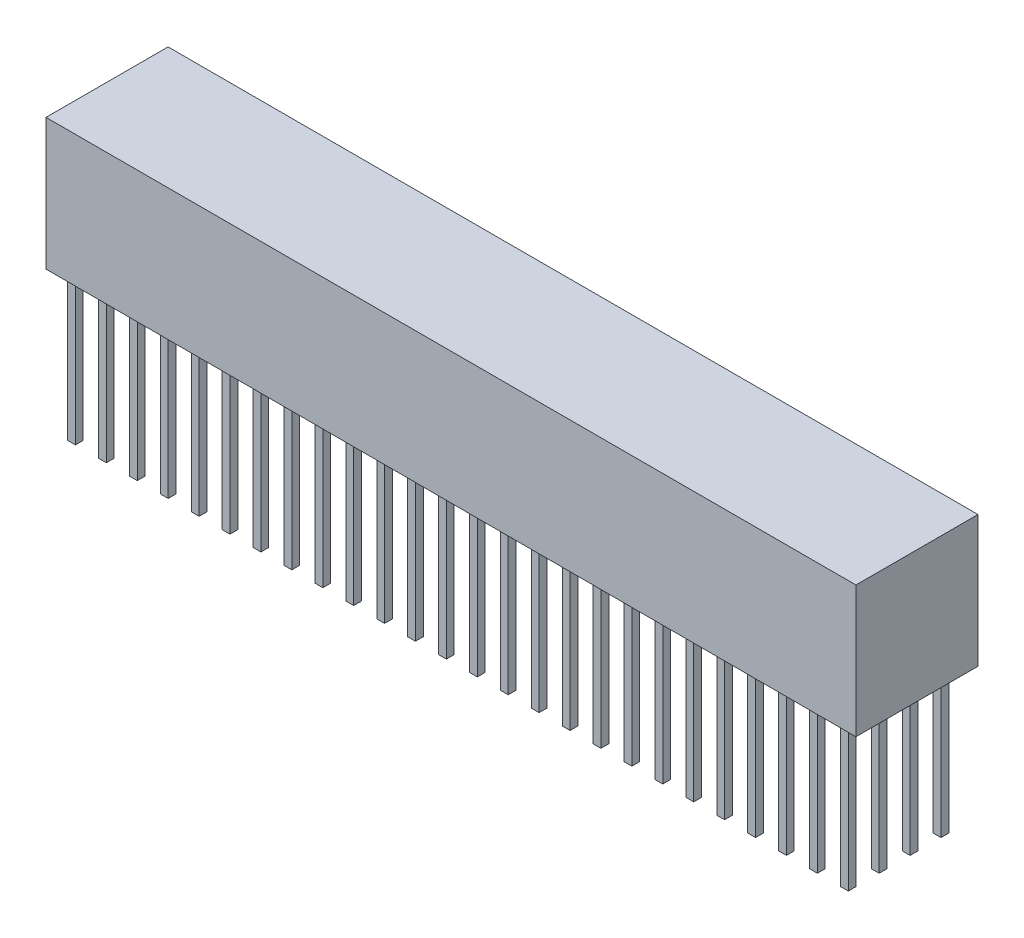
from build123d import *

# Parameters (mm, degrees)
SKETCH1_W           = 66.55
SKETCH1_H           = 10.03
BOSS_EXTRUDE1_DEPTH = 10.8
SKETCH2_W           = 0.64
SKETCH2_H           = 0.64
BOSS_EXTRUDE2_DEPTH = 12.19


with BuildPart() as part:
    # Sketch1 → Boss-Extrude1 (new body)
    with BuildSketch(Plane(origin=(0, 0, 0), x_dir=(1, 0, 0), z_dir=(0, 1, 0))):
        with Locations((33.275, 5.015)):
            Rectangle(SKETCH1_W, SKETCH1_H)
    extrude(amount=BOSS_EXTRUDE1_DEPTH)

    # Sketch2 → Boss-Extrude2 (add)
    with BuildSketch(Plane.XZ):
        with Locations((1.21, -1.21)):
            Rectangle(SKETCH2_W, SKETCH2_H)
        with Locations((3.75, -1.21)):
            Rectangle(SKETCH2_W, SKETCH2_H)
        with Locations((6.29, -1.21)):
            Rectangle(SKETCH2_W, SKETCH2_H)
        with Locations((8.83, -1.21)):
            Rectangle(SKETCH2_W, SKETCH2_H)
        with Locations((11.37, -1.21)):
            Rectangle(SKETCH2_W, SKETCH2_H)
        with Locations((13.91, -1.21)):
            Rectangle(SKETCH2_W, SKETCH2_H)
        with Locations((16.45, -1.21)):
            Rectangle(SKETCH2_W, SKETCH2_H)
        with Locations((18.99, -1.21)):
            Rectangle(SKETCH2_W, SKETCH2_H)
        with Locations((21.53, -1.21)):
            Rectangle(SKETCH2_W, SKETCH2_H)
        with Locations((24.07, -1.21)):
            Rectangle(SKETCH2_W, SKETCH2_H)
        with Locations((26.61, -1.21)):
            Rectangle(SKETCH2_W, SKETCH2_H)
        with Locations((29.15, -1.21)):
            Rectangle(SKETCH2_W, SKETCH2_H)
        with Locations((31.69, -1.21)):
            Rectangle(SKETCH2_W, SKETCH2_H)
        with Locations((34.23, -1.21)):
            Rectangle(SKETCH2_W, SKETCH2_H)
        with Locations((36.77, -1.21)):
            Rectangle(SKETCH2_W, SKETCH2_H)
        with Locations((39.31, -1.21)):
            Rectangle(SKETCH2_W, SKETCH2_H)
        with Locations((41.85, -1.21)):
            Rectangle(SKETCH2_W, SKETCH2_H)
        with Locations((44.39, -1.21)):
            Rectangle(SKETCH2_W, SKETCH2_H)
        with Locations((46.93, -1.21)):
            Rectangle(SKETCH2_W, SKETCH2_H)
        with Locations((49.47, -1.21)):
            Rectangle(SKETCH2_W, SKETCH2_H)
        with Locations((52.01, -1.21)):
            Rectangle(SKETCH2_W, SKETCH2_H)
        with Locations((54.55, -1.21)):
            Rectangle(SKETCH2_W, SKETCH2_H)
        with Locations((57.09, -1.21)):
            Rectangle(SKETCH2_W, SKETCH2_H)
        with Locations((59.63, -1.21)):
            Rectangle(SKETCH2_W, SKETCH2_H)
        with Locations((62.17, -1.21)):
            Rectangle(SKETCH2_W, SKETCH2_H)
        with Locations((3.75, -3.75)):
            Rectangle(SKETCH2_W, SKETCH2_H)
        with Locations((6.29, -3.75)):
            Rectangle(SKETCH2_W, SKETCH2_H)
        with Locations((8.83, -3.75)):
            Rectangle(SKETCH2_W, SKETCH2_H)
        with Locations((11.37, -3.75)):
            Rectangle(SKETCH2_W, SKETCH2_H)
        with Locations((13.91, -3.75)):
            Rectangle(SKETCH2_W, SKETCH2_H)
        with Locations((16.45, -3.75)):
            Rectangle(SKETCH2_W, SKETCH2_H)
        with Locations((18.99, -3.75)):
            Rectangle(SKETCH2_W, SKETCH2_H)
        with Locations((21.53, -3.75)):
            Rectangle(SKETCH2_W, SKETCH2_H)
        with Locations((24.07, -3.75)):
            Rectangle(SKETCH2_W, SKETCH2_H)
        with Locations((26.61, -3.75)):
            Rectangle(SKETCH2_W, SKETCH2_H)
        with Locations((29.15, -3.75)):
            Rectangle(SKETCH2_W, SKETCH2_H)
        with Locations((31.69, -3.75)):
            Rectangle(SKETCH2_W, SKETCH2_H)
        with Locations((34.23, -3.75)):
            Rectangle(SKETCH2_W, SKETCH2_H)
        with Locations((36.77, -3.75)):
            Rectangle(SKETCH2_W, SKETCH2_H)
        with Locations((39.31, -3.75)):
            Rectangle(SKETCH2_W, SKETCH2_H)
        with Locations((41.85, -3.75)):
            Rectangle(SKETCH2_W, SKETCH2_H)
        with Locations((44.39, -3.75)):
            Rectangle(SKETCH2_W, SKETCH2_H)
        with Locations((46.93, -3.75)):
            Rectangle(SKETCH2_W, SKETCH2_H)
        with Locations((49.47, -3.75)):
            Rectangle(SKETCH2_W, SKETCH2_H)
        with Locations((52.01, -3.75)):
            Rectangle(SKETCH2_W, SKETCH2_H)
        with Locations((54.55, -3.75)):
            Rectangle(SKETCH2_W, SKETCH2_H)
        with Locations((57.09, -3.75)):
            Rectangle(SKETCH2_W, SKETCH2_H)
        with Locations((59.63, -3.75)):
            Rectangle(SKETCH2_W, SKETCH2_H)
        with Locations((62.17, -3.75)):
            Rectangle(SKETCH2_W, SKETCH2_H)
        with Locations((3.75, -6.29)):
            Rectangle(SKETCH2_W, SKETCH2_H)
        with Locations((6.29, -6.29)):
            Rectangle(SKETCH2_W, SKETCH2_H)
        with Locations((8.83, -6.29)):
            Rectangle(SKETCH2_W, SKETCH2_H)
        with Locations((11.37, -6.29)):
            Rectangle(SKETCH2_W, SKETCH2_H)
        with Locations((13.91, -6.29)):
            Rectangle(SKETCH2_W, SKETCH2_H)
        with Locations((16.45, -6.29)):
            Rectangle(SKETCH2_W, SKETCH2_H)
        with Locations((18.99, -6.29)):
            Rectangle(SKETCH2_W, SKETCH2_H)
        with Locations((21.53, -6.29)):
            Rectangle(SKETCH2_W, SKETCH2_H)
        with Locations((24.07, -6.29)):
            Rectangle(SKETCH2_W, SKETCH2_H)
        with Locations((26.61, -6.29)):
            Rectangle(SKETCH2_W, SKETCH2_H)
        with Locations((29.15, -6.29)):
            Rectangle(SKETCH2_W, SKETCH2_H)
        with Locations((31.69, -6.29)):
            Rectangle(SKETCH2_W, SKETCH2_H)
        with Locations((34.23, -6.29)):
            Rectangle(SKETCH2_W, SKETCH2_H)
        with Locations((36.77, -6.29)):
            Rectangle(SKETCH2_W, SKETCH2_H)
        with Locations((39.31, -6.29)):
            Rectangle(SKETCH2_W, SKETCH2_H)
        with Locations((41.85, -6.29)):
            Rectangle(SKETCH2_W, SKETCH2_H)
        with Locations((44.39, -6.29)):
            Rectangle(SKETCH2_W, SKETCH2_H)
        with Locations((46.93, -6.29)):
            Rectangle(SKETCH2_W, SKETCH2_H)
        with Locations((49.47, -6.29)):
            Rectangle(SKETCH2_W, SKETCH2_H)
        with Locations((52.01, -6.29)):
            Rectangle(SKETCH2_W, SKETCH2_H)
        with Locations((54.55, -6.29)):
            Rectangle(SKETCH2_W, SKETCH2_H)
        with Locations((57.09, -6.29)):
            Rectangle(SKETCH2_W, SKETCH2_H)
        with Locations((59.63, -6.29)):
            Rectangle(SKETCH2_W, SKETCH2_H)
        with Locations((62.17, -6.29)):
            Rectangle(SKETCH2_W, SKETCH2_H)
        with Locations((3.75, -8.83)):
            Rectangle(SKETCH2_W, SKETCH2_H)
        with Locations((6.29, -8.83)):
            Rectangle(SKETCH2_W, SKETCH2_H)
        with Locations((8.83, -8.83)):
            Rectangle(SKETCH2_W, SKETCH2_H)
        with Locations((11.37, -8.83)):
            Rectangle(SKETCH2_W, SKETCH2_H)
        with Locations((13.91, -8.83)):
            Rectangle(SKETCH2_W, SKETCH2_H)
        with Locations((16.45, -8.83)):
            Rectangle(SKETCH2_W, SKETCH2_H)
        with Locations((18.99, -8.83)):
            Rectangle(SKETCH2_W, SKETCH2_H)
        with Locations((21.53, -8.83)):
            Rectangle(SKETCH2_W, SKETCH2_H)
        with Locations((24.07, -8.83)):
            Rectangle(SKETCH2_W, SKETCH2_H)
        with Locations((26.61, -8.83)):
            Rectangle(SKETCH2_W, SKETCH2_H)
        with Locations((29.15, -8.83)):
            Rectangle(SKETCH2_W, SKETCH2_H)
        with Locations((31.69, -8.83)):
            Rectangle(SKETCH2_W, SKETCH2_H)
        with Locations((34.23, -8.83)):
            Rectangle(SKETCH2_W, SKETCH2_H)
        with Locations((36.77, -8.83)):
            Rectangle(SKETCH2_W, SKETCH2_H)
        with Locations((39.31, -8.83)):
            Rectangle(SKETCH2_W, SKETCH2_H)
        with Locations((41.85, -8.83)):
            Rectangle(SKETCH2_W, SKETCH2_H)
        with Locations((44.39, -8.83)):
            Rectangle(SKETCH2_W, SKETCH2_H)
        with Locations((46.93, -8.83)):
            Rectangle(SKETCH2_W, SKETCH2_H)
        with Locations((49.47, -8.83)):
            Rectangle(SKETCH2_W, SKETCH2_H)
        with Locations((52.01, -8.83)):
            Rectangle(SKETCH2_W, SKETCH2_H)
        with Locations((54.55, -8.83)):
            Rectangle(SKETCH2_W, SKETCH2_H)
        with Locations((57.09, -8.83)):
            Rectangle(SKETCH2_W, SKETCH2_H)
        with Locations((59.63, -8.83)):
            Rectangle(SKETCH2_W, SKETCH2_H)
        with Locations((62.17, -8.83)):
            Rectangle(SKETCH2_W, SKETCH2_H)
        with Locations((1.21, -3.75)):
            Rectangle(SKETCH2_W, SKETCH2_H)
        with Locations((1.21, -6.29)):
            Rectangle(SKETCH2_W, SKETCH2_H)
        with Locations((1.21, -8.83)):
            Rectangle(SKETCH2_W, SKETCH2_H)
        with Locations((64.71, -1.21)):
            Rectangle(SKETCH2_W, SKETCH2_H)
        with Locations((64.71, -3.75)):
            Rectangle(SKETCH2_W, SKETCH2_H)
        with Locations((64.71, -6.29)):
            Rectangle(SKETCH2_W, SKETCH2_H)
        with Locations((64.71, -8.83)):
            Rectangle(SKETCH2_W, SKETCH2_H)
    extrude(amount=BOSS_EXTRUDE2_DEPTH)


solid = part.part
